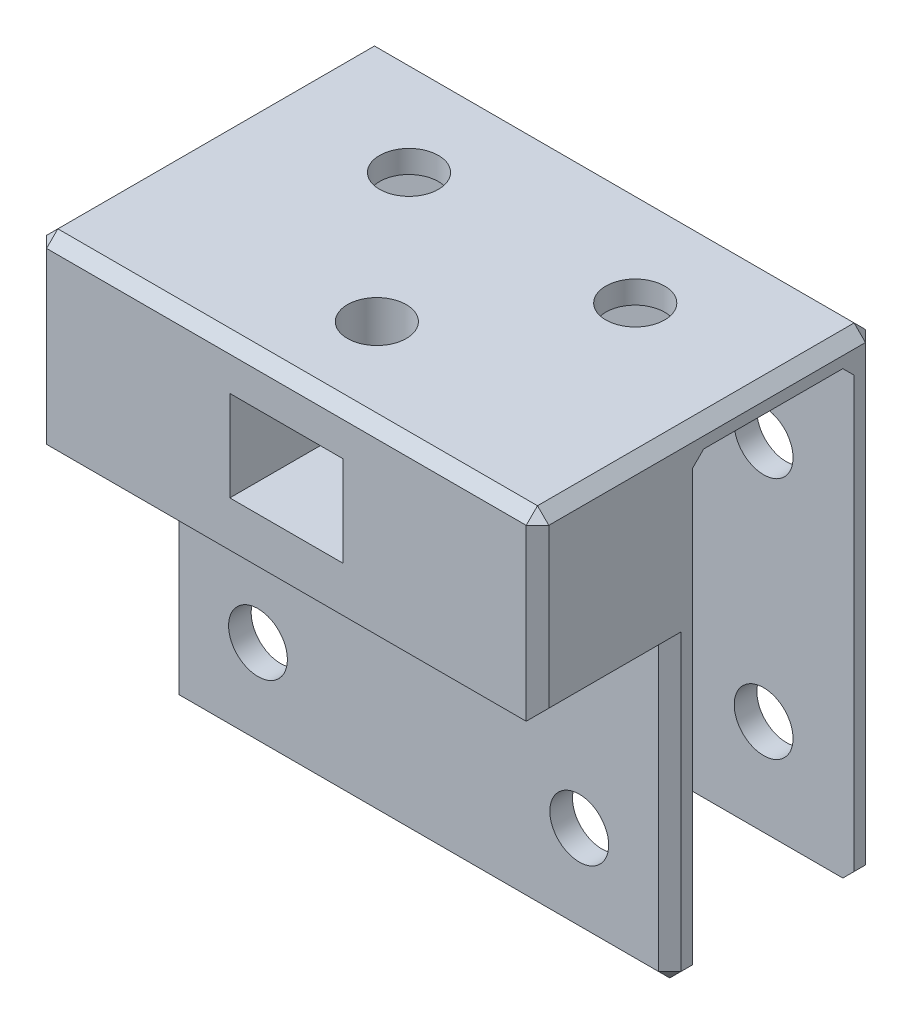
from build123d import *

# Parameters (mm, degrees)
SKETCH1_W           = 44.4
SKETCH1_H           = 40
SKETCH1_R           = 2.6
BOSS_EXTRUDE1_DEPTH = 2
SKETCH2_W           = 44.4
SKETCH2_H           = 18.3
BOSS_EXTRUDE2_DEPTH = 2
LPATTERN1_COUNT     = 2
LPATTERN1_PITCH     = 16.3
SKETCH3_R           = 2.6
CUT_EXTRUDE1_DEPTH  = 64.253853638
BOSS_EXTRUDE3_START = -22.2
SKETCH6_W           = 11.69
SKETCH6_H           = 16
BOSS_EXTRUDE3_DEPTH = 44.4
FILLET4_SIZE        = 1
SKETCH12_W          = 10
SKETCH12_H          = 8.384441544
CUT_EXTRUDE7_DEPTH  = 11
SKETCH11_R          = 2.6
CUT_EXTRUDE8_DEPTH  = 10
CUT_EXTRUDE9_REACH  = 70.079
SKETCH13_W          = 10
SKETCH13_H          = 8


with BuildPart() as part:
    # Sketch1 → Boss-Extrude1 (new body)
    with BuildSketch(Plane.XY):
        with Locations((22.2, 20)):
            Rectangle(SKETCH1_W, SKETCH1_H)
        with Locations((8, 8.476902454)):
            Circle(SKETCH1_R, mode=Mode.SUBTRACT)
        with Locations((8, 29.976902454)):
            Circle(SKETCH1_R, mode=Mode.SUBTRACT)
        with Locations((36.4, 29.976902454)):
            Circle(SKETCH1_R, mode=Mode.SUBTRACT)
        with Locations((36.4, 8.476902454)):
            Circle(SKETCH1_R, mode=Mode.SUBTRACT)
    boss_extrude1 = extrude(amount=BOSS_EXTRUDE1_DEPTH)

    # Sketch2 → Boss-Extrude2 (add)
    with BuildSketch(Plane(origin=(0, 40, 0), x_dir=(1, 0, 0), z_dir=(0, 1, 0))):
        with Locations((22.2, 7.15)):
            Rectangle(SKETCH2_W, SKETCH2_H)
    extrude(amount=BOSS_EXTRUDE2_DEPTH)

    # LPattern1: Boss-Extrude1 ×2
    with Locations(*[(0, 0, -i * LPATTERN1_PITCH) for i in range(1, LPATTERN1_COUNT)]):
        add(boss_extrude1)

    # Sketch3 → Cut-Extrude1 (cut, through all)
    with BuildSketch(Plane(origin=(0, 42, 0), x_dir=(1, 0, 0), z_dir=(0, 1, 0))):
        with Locations(Location((12.2, 7.15, 0), (0, 0, 270))):
            Circle(SKETCH3_R)
        with Locations(Location((32.2, 7.15, 0), (0, 0, 270))):
            Circle(SKETCH3_R)
    extrude(amount=-CUT_EXTRUDE1_DEPTH, mode=Mode.SUBTRACT)

    # Sketch6 → Boss-Extrude3 (add)
    with BuildSketch(Plane(origin=(22.2, 0, 0), x_dir=(0, 0, -1), z_dir=(1, 0, 0)).offset(BOSS_EXTRUDE3_START)):
        with Locations((-7.845, 34)):
            Rectangle(SKETCH6_W, SKETCH6_H)
    extrude(amount=BOSS_EXTRUDE3_DEPTH)

    # Fillet4
    fillet4_edges = [part.edges().sort_by_distance(p)[0] for p in [
        (44.4, 13, 2),
        (0, 21, -16.3),
        (44.4, 21, -16.3),
        (0, 42, -1.305),
        (44.4, 42, -1.305),
        (22.2, 42, -16.3),
        (22.2, 40, -14.3),
        (22.2, 0, -16.3),
        (0, 0, -15.3),
        (44.4, 0, -15.3),
        (22.2, 40, 0),
        (0, 13, 2),
        (44.4, 26, 7.845),
        (44.4, 34, 13.69),
        (22.2, 42, 13.69),
        (0, 26, 7.845),
        (0, 34, 13.69),
        (44.4, 0, 1),
        (0, 0, 1),
        (22.2, 0, 2),
    ]]
    chamfer(fillet4_edges, length=FILLET4_SIZE)

    # Sketch12 → Cut-Extrude7 (cut)
    with BuildSketch(Plane.XZ.offset(-26)):
        with Locations((8, 6.192220772)):
            Rectangle(SKETCH12_W, SKETCH12_H)
        with Locations((36.4, 6.192220772)):
            Rectangle(SKETCH12_W, SKETCH12_H)
    extrude(amount=-CUT_EXTRUDE7_DEPTH, mode=Mode.SUBTRACT)

    # Sketch11 → Cut-Extrude8 (cut)
    with BuildSketch(Plane(origin=(0, 42, 0), x_dir=(1, 0, 0), z_dir=(0, 1, 0))):
        with Locations(Location((22.2, -5.69, 0), (0, 0, 270))):
            Circle(SKETCH11_R)
    extrude(amount=-CUT_EXTRUDE8_DEPTH, mode=Mode.SUBTRACT)

    # Cut-Extrude9: up to this face of the body (flat: up to its plane)
    cut_extrude9_end = Plane(part.part.faces().sort_by_distance((22.2, 16.406575792, 2))[0])
    # Sketch13 → Cut-Extrude9 (cut, up to the picked face)
    with BuildSketch(Plane.XY.offset(13.69), mode=Mode.PRIVATE) as cut_extrude9_sk1:
        with Locations((22.2, 34)):
            Rectangle(SKETCH13_W, SKETCH13_H)
    cut_extrude9_tool1 = split(extrude(cut_extrude9_sk1.sketch, amount=-CUT_EXTRUDE9_REACH, mode=Mode.PRIVATE), bisect_by=cut_extrude9_end, keep=Keep.BOTH, mode=Mode.PRIVATE)
    add(cut_extrude9_tool1.solids().sort_by(Axis((22.2, 34, 13.69), (0, 0, -1)))[0], mode=Mode.SUBTRACT)


solid = part.part
